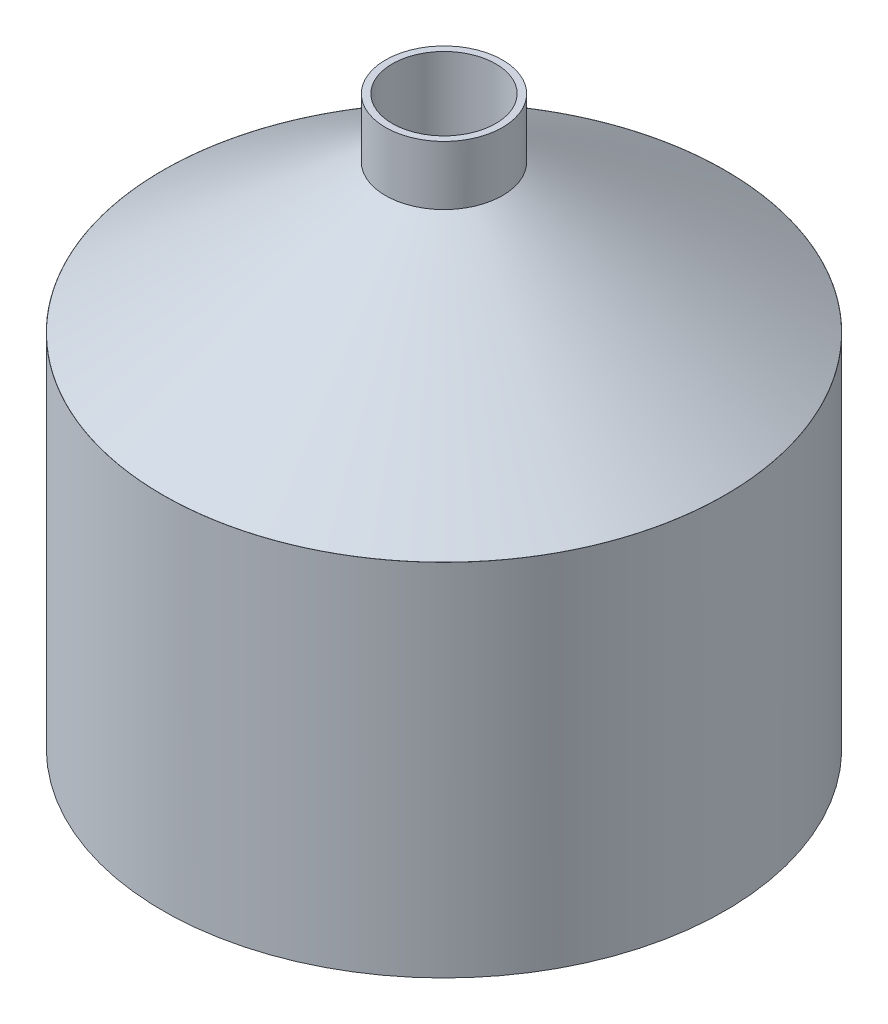
from build123d import *

# Parameters (mm, degrees)
SKETCH1_R           = 62.5
SKETCH1_R_2         = 61.5
BOSS_EXTRUDE1_DEPTH = 80
SKETCH3_W           = 7.6
SKETCH3_H           = 23.660429452
CUT_EXTRUDE1_DEPTH  = 80
SKETCH5_R           = 12.3
CUT_EXTRUDE3_DEPTH  = 229
BOSS_EXTRUDE3_START = 106
SKETCH6_R           = 13
SKETCH6_R_2         = 11.5
BOSS_EXTRUDE3_DEPTH = 20


with BuildPart() as part:
    # Sketch1 → Boss-Extrude1 (new body)
    with BuildSketch(Plane(origin=(0, 0, 0), x_dir=(1, 0, 0), z_dir=(0, 1, 0))):
        with Locations(Location((0, 0, 0), (0, 0, 270))):
            Circle(SKETCH1_R)
        with Locations(Location((0, 0, 0), (0, 0, 270))):
            Circle(SKETCH1_R_2, mode=Mode.SUBTRACT)
    extrude(amount=BOSS_EXTRUDE1_DEPTH)

    # Sketch2 → Revolve1 (revolve)
    with BuildSketch(Plane.XY, mode=Mode.PRIVATE) as revolve1_sk:
        Polygon((-62.472592019, 80), (-62.472592019, 79.276884175), (-61.5, 79.276884175), (-61.5, 80), (-4.8, 117.682815259), (-4.8, 129.995512562), (-8, 129.995512562), (-8, 127), (-6.8, 127), (-6.8, 117), align=None)
    revolve(revolve1_sk.sketch.rotate(Axis((0, 80, 0), (0, 1, 0)), 270), axis=Axis((0, 80, 0), (0, 1, 0)))

    # Sketch3 → Cut-Extrude1 (cut)
    with BuildSketch(Plane.XY):
        with Locations((0, 9.876009184)):
            Rectangle(SKETCH3_W, SKETCH3_H)
    extrude(amount=-CUT_EXTRUDE1_DEPTH, mode=Mode.SUBTRACT)

    # Sketch5 → Cut-Extrude3 (cut)
    with BuildSketch(Plane(origin=(0, 0, 0), x_dir=(1, 0, 0), z_dir=(0, 1, 0))):
        with Locations(Location((0, 0, 0), (0, 0, 90))):
            Circle(SKETCH5_R)
    extrude(amount=CUT_EXTRUDE3_DEPTH, mode=Mode.SUBTRACT)

    # Sketch6 → Boss-Extrude3 (add)
    with BuildSketch(Plane(origin=(0, 0, 0), x_dir=(1, 0, 0), z_dir=(0, 1, 0)).offset(BOSS_EXTRUDE3_START)):
        with Locations(Location((0, 0, 0), (0, 0, 90))):
            Circle(SKETCH6_R)
        with Locations(Location((0, 0, 0), (0, 0, 270))):
            Circle(SKETCH6_R_2, mode=Mode.SUBTRACT)
    extrude(amount=BOSS_EXTRUDE3_DEPTH)


solid = part.part
